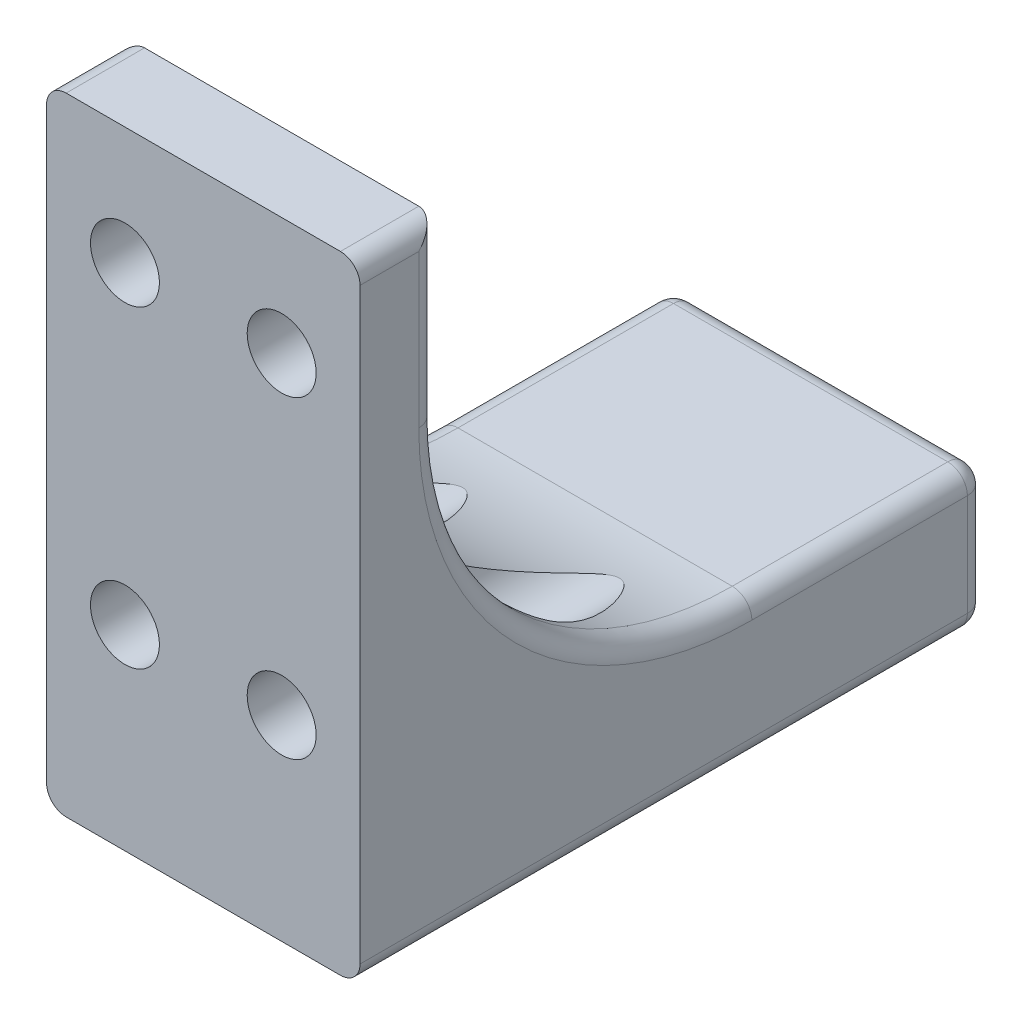
from build123d import *

# Parameters (mm, degrees)
BOSS_EXTRUDE1_DEPTH = 25.4
FILLET1_R           = 25.4
SKETCH2_R           = 2.794
CUT_EXTRUDE1_DEPTH  = 77.2
CUT_EXTRUDE2_START  = -6.35
SKETCH3_R           = 4.064
CUT_EXTRUDE2_DEPTH  = 70.850000033
FILLET2_R           = 1.5875


with BuildPart() as part:
    # Sketch1 → Boss-Extrude1 (new body)
    with BuildSketch(Plane(origin=(0, 0, 0), x_dir=(0, 0, -1), z_dir=(1, 0, 0))):
        Polygon((0, 0), (0, 50.8), (6.35, 50.8), (6.35, 11.43), (50.8, 11.43), (50.8, 0), align=None)
    extrude(amount=BOSS_EXTRUDE1_DEPTH)

    # Fillet1
    fillet1_edges = [part.edges().sort_by_distance(p)[0] for p in [
        (12.7, 11.43, -6.35),
    ]]
    fillet(fillet1_edges, radius=FILLET1_R)

    # Sketch2 → Cut-Extrude1 (cut, through all)
    with BuildSketch(Plane.XY):
        with Locations((6.35, 41.275)):
            Circle(SKETCH2_R)
        with Locations((6.35, 15.875)):
            Circle(SKETCH2_R)
        with Locations(Location((19.05, 41.275, 0), (0, 0, 270))):
            Circle(SKETCH2_R)
        with Locations((19.05, 15.875)):
            Circle(SKETCH2_R)
    extrude(amount=-CUT_EXTRUDE1_DEPTH, mode=Mode.SUBTRACT)

    # Sketch3 → Cut-Extrude2 (cut, through all)
    with BuildSketch(Plane.XY.offset(CUT_EXTRUDE2_START)):
        with Locations((6.35, 15.875)):
            Circle(SKETCH3_R)
        with Locations((19.05, 15.875)):
            Circle(SKETCH3_R)
    extrude(amount=-CUT_EXTRUDE2_DEPTH, mode=Mode.SUBTRACT)

    # Fillet2
    fillet2_edges = [part.edges().sort_by_distance(p)[0] for p in [
        (12.7, 11.43, -50.8),
        (12.7, 0, -50.8),
        (25.4, 11.43, -41.275),
        (0, 43.815, -6.35),
        (25.4, 43.815, -6.35),
        (25.4, 50.8, -3.175),
        (0, 18.869487758, -13.789487758),
        (25.4, 18.869487758, -13.789487758),
        (25.4, 0, -25.4),
        (0, 50.8, -3.175),
        (0, 11.43, -41.275),
        (0, 5.715, -50.8),
        (0, 0, -25.4),
        (25.4, 5.715, -50.8),
    ]]
    fillet(fillet2_edges, radius=FILLET2_R)


solid = part.part
